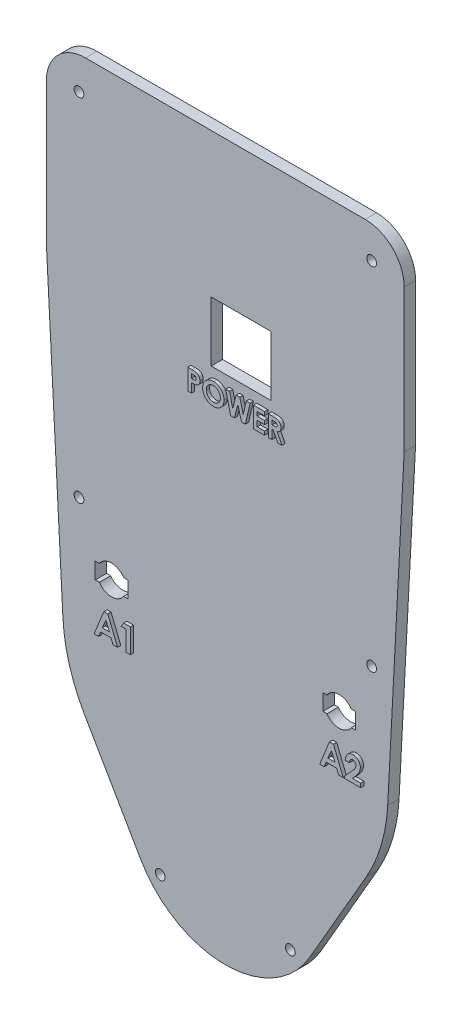
from build123d import *

# Parameters (mm, degrees)
SKETCH5_R           = 1.5
SKETCH5_W           = 18.4
SKETCH5_H           = 18.4
BOSS_EXTRUDE2_DEPTH = 3.5
BOSS_EXTRUDE3_DEPTH = 1


with BuildPart() as part:
    # Sketch5 → Boss-Extrude2 (new body)
    with BuildSketch(Plane.XY):
        with BuildLine():
            Line((54.996270394, 98.017748309), (54.996270394, 54.11413567))
            Line((54.996270394, 54.11413567), (49.927747132, -42.599049503))
            ThreePointArc((49.927747132, -42.599049503), (47.937257137, -54.183018926), (43.297540583, -64.982251691))
            Line((43.297540583, -64.982251691), (25.977032507, -94.982251691))
            ThreePointArc((25.977032507, -94.982251691), (-0.003729606, -109.982251691), (-25.98449172, -94.982251691))
            Line((-25.98449172, -94.982251691), (-43.304999795, -64.982251691))
            ThreePointArc((-43.304999795, -64.982251691), (-47.944716349, -54.183018926), (-49.935206344, -42.599049503))
            Line((-49.935206344, -42.599049503), (-55.003729606, 54.11413567))
            Line((-55.003729606, 54.11413567), (-55.003729606, 98.017748309))
            ThreePointArc((-55.003729606, 98.017748309), (-51.48901098, 106.503029684), (-43.003729606, 110.017748309))
            Line((-43.003729606, 110.017748309), (42.996270394, 110.017748309))
            ThreePointArc((42.996270394, 110.017748309), (51.481551768, 106.503029684), (54.996270394, 98.017748309))
        make_face()
        with Locations((20, -96)):
            Circle(SKETCH5_R, mode=Mode.SUBTRACT)
        with Locations((-20, -96)):
            Circle(SKETCH5_R, mode=Mode.SUBTRACT)
        with Locations((45, -7.999756325)):
            Circle(SKETCH5_R, mode=Mode.SUBTRACT)
        with Locations((-45, -7.999756325)):
            Circle(SKETCH5_R, mode=Mode.SUBTRACT)
        with Locations((45, 100)):
            Circle(SKETCH5_R, mode=Mode.SUBTRACT)
        with Locations((-45, 100)):
            Circle(SKETCH5_R, mode=Mode.SUBTRACT)
        with BuildLine():
            ThreePointArc((31.258343135, -27.5), (35.000000522, -29.5), (38.741657908, -27.5))
            Line((38.741657908, -27.5), (40.000000522, -27.5))
            Line((40.000000522, -27.5), (40.000000522, -22.5))
            Line((40.000000522, -22.5), (38.741657908, -22.5))
            ThreePointArc((38.741657908, -22.5), (35.000000522, -20.5), (31.258343135, -22.5))
            Line((31.258343135, -22.5), (30.000000522, -22.5))
            Line((30.000000522, -22.5), (30.000000522, -27.5))
            Line((30.000000522, -27.5), (31.258343135, -27.5))
        make_face(mode=Mode.SUBTRACT)
        with BuildLine():
            ThreePointArc((-31.258343135, -22.5), (-35.000000522, -20.5), (-38.741657908, -22.5))
            Line((-38.741657908, -22.5), (-40.000000522, -22.5))
            Line((-40.000000522, -22.5), (-40.000000522, -27.5))
            Line((-40.000000522, -27.5), (-38.741657908, -27.5))
            ThreePointArc((-38.741657908, -27.5), (-35.000000522, -29.5), (-31.258343135, -27.5))
            Line((-31.258343135, -27.5), (-30.000000522, -27.5))
            Line((-30.000000522, -27.5), (-30.000000522, -22.5))
            Line((-30.000000522, -22.5), (-31.258343135, -22.5))
        make_face(mode=Mode.SUBTRACT)
        with Locations((4.859065871, 56.4953)):
            Rectangle(SKETCH5_W, SKETCH5_H, mode=Mode.SUBTRACT)
    extrude(amount=BOSS_EXTRUDE2_DEPTH)

    # Sketch6 → Boss-Extrude3 (add)
    # profile 1 of 9: a face of its own
    with BuildSketch(Plane.XY.offset(3.5)):
        with BuildLine():
            Line((-10.544251547, 44.383539956), (-9.27221629, 44.383539956))
            add(Edge.make_bspline(
                [(-9.27221629, 44.383539956), (-9.189103157, 44.383167924), (-9.028760501, 44.382450196), (-8.797533199, 44.373746791), (-8.584214691, 44.35814976), (-8.388853988, 44.338874295), (-8.211531416, 44.311850843), (-8.052024914, 44.280870572), (-7.910301381, 44.243127584), (-7.784762674, 44.198327182), (-7.672095739, 44.145509257), (-7.56547648, 44.089254397), (-7.467314505, 44.022116206), (-7.372655281, 43.951330553), (-7.286910639, 43.870135311), (-7.204731317, 43.783934142), (-7.129597831, 43.689308378), (-7.061162042, 43.587403439), (-6.999080236, 43.480102092), (-6.944841417, 43.367212514), (-6.900845925, 43.248556069), (-6.863939177, 43.12490033), (-6.834295318, 42.996250686), (-6.814563422, 42.86181593), (-6.801160525, 42.722534736), (-6.799977905, 42.627739867), (-6.799379752, 42.579793963)],
                knots=[0, 0, 0, 0, 1.698747864, 3.27724071, 4.728299578, 6.070144658, 7.288476769, 8.393259625, 9.389771311, 10.283485332, 11.113357557, 11.931608583, 12.74405601, 13.541433047, 14.344816069, 15.154114104, 15.974336324, 16.810834471, 17.661136416, 18.50621059, 19.367396281, 20.244825668, 21.142564693, 22.063065223, 23.020325768, 24, 24, 24, 24], degree=3))
            add(Edge.make_bspline(
                [(-6.799379752, 42.579793963), (-6.800245204, 42.52675255), (-6.801945924, 42.422519656), (-6.818618459, 42.269727022), (-6.847100417, 42.124053079), (-6.884324846, 41.984269332), (-6.936231665, 41.852675535), (-6.995532768, 41.726131818), (-7.068491934, 41.60818608), (-7.151859446, 41.49736296), (-7.242906279, 41.392761416), (-7.343793882, 41.297401618), (-7.452599295, 41.210633502), (-7.56869268, 41.131547731), (-7.692509888, 41.06030384), (-7.823961578, 40.996234704), (-7.963945378, 40.941389454), (-8.061425884, 40.912705832), (-8.110848101, 40.898163354)],
                knots=[0, 0, 0, 0, 1.102006807, 2.165578795, 3.188629044, 4.184801286, 5.166646146, 6.124351954, 7.085497154, 8.042432466, 9.003981491, 9.963833307, 10.922997304, 11.89326795, 12.880200226, 13.889073926, 14.929769137, 16, 16, 16, 16], degree=3))
            add(Edge.make_bspline(
                [(-8.110848101, 40.898163354), (-8.143400416, 40.890064285), (-8.213919213, 40.872519094), (-8.330608453, 40.854706322), (-8.46508055, 40.838328573), (-8.617770341, 40.82425388), (-8.788765855, 40.814686369), (-8.977901523, 40.807214568), (-9.185263059, 40.801781797), (-9.329454071, 40.801589019), (-9.404507957, 40.801488674)],
                knots=[0, 0, 0, 0, 0.618981996, 1.340914327, 2.176866532, 3.120127938, 4.170906482, 5.338178032, 6.614476169, 8, 8, 8, 8], degree=3))
            Line((-9.404507957, 40.801488674), (-9.404507957, 38.033539956))
            Line((-9.404507957, 38.033539956), (-10.544251547, 38.033539956))
            Line((-10.544251547, 38.033539956), (-10.544251547, 44.383539956))
        make_face()
        with BuildLine():
            Line((-9.404507957, 41.941232264), (-9.001272781, 41.941232264))
            add(Edge.make_bspline(
                [(-9.001272781, 41.941232264), (-8.927897774, 41.941697518), (-8.792886672, 41.942553594), (-8.608509184, 41.954932938), (-8.460339887, 41.973838698), (-8.343283392, 42.00095393), (-8.250856201, 42.042104885), (-8.171143536, 42.08970879), (-8.102771948, 42.149902622), (-8.043572216, 42.218684374), (-7.996243814, 42.297718055), (-7.963424033, 42.385716754), (-7.942104948, 42.480831525), (-7.940135933, 42.54702511), (-7.939123342, 42.581065998)],
                knots=[0, 0, 0, 0, 1.8619151, 3.425951444, 4.686033666, 5.651700536, 6.461346321, 7.243864085, 7.999046032, 8.762387399, 9.539336099, 10.322741239, 11.137448474, 12, 12, 12, 12], degree=3))
            add(Edge.make_bspline(
                [(-7.939123342, 42.581065998), (-7.940125517, 42.610807079), (-7.942069978, 42.668511926), (-7.956354517, 42.751794333), (-7.979119963, 42.829430717), (-8.01210622, 42.900610268), (-8.054749639, 42.965212042), (-8.106740597, 43.023210589), (-8.167411946, 43.075847996), (-8.214253775, 43.10370978), (-8.238051627, 43.117864876)],
                knots=[0, 0, 0, 0, 1.102301479, 2.1387299, 3.123554645, 4.094223062, 5.036071848, 5.982632524, 6.975082478, 8, 8, 8, 8], degree=3))
            add(Edge.make_bspline(
                [(-8.238051627, 43.117864876), (-8.258209781, 43.128059433), (-8.300888723, 43.149643398), (-8.373575101, 43.174736335), (-8.45745407, 43.195904992), (-8.553091909, 43.213474773), (-8.660107091, 43.227110748), (-8.778480522, 43.237538858), (-8.908386401, 43.241732407), (-8.998728167, 43.243089404), (-9.045794015, 43.243796367)],
                knots=[0, 0, 0, 0, 0.656809284, 1.390599849, 2.23162475, 3.173112763, 4.218524733, 5.370385145, 6.63003504, 8, 8, 8, 8], degree=3))
            Line((-9.045794015, 43.243796367), (-9.404507957, 43.243796367))
            Line((-9.404507957, 43.243796367), (-9.404507957, 41.941232264))
        make_face(mode=Mode.SUBTRACT)
    # profile 2 of 9: a face of its own
    with BuildSketch(Plane.XY.offset(3.5)):
        with BuildLine():
            add(Edge.make_bspline(
                [(-2.675441451, 44.546360469), (-2.565038918, 44.54350195), (-2.347079314, 44.537858585), (-2.026539389, 44.490816738), (-1.717639904, 44.414168792), (-1.420520542, 44.307622603), (-1.135925256, 44.168292358), (-0.862850182, 44.000128163), (-0.602273464, 43.799956017), (-0.356865282, 43.572445608), (-0.130063861, 43.325037972), (0.066459702, 43.058659667), (0.234047787, 42.780212821), (0.37294524, 42.488951328), (0.478741504, 42.182858064), (0.552983119, 41.863493699), (0.600679678, 41.530949091), (0.606165516, 41.304531539), (0.608953581, 41.189459427)],
                knots=[0, 0, 0, 0, 1.014329547, 2.002516266, 2.970391464, 3.935626869, 4.897733899, 5.877609409, 6.878433252, 7.912639331, 8.949961323, 9.958554974, 10.949718813, 11.932905612, 12.9188844, 13.919928257, 14.942845884, 16, 16, 16, 16], degree=3))
            add(Edge.make_bspline(
                [(0.608953581, 41.189459427), (0.605984412, 41.075683913), (0.600133569, 40.851485611), (0.554930301, 40.522005532), (0.479438449, 40.206062226), (0.375436572, 39.902940547), (0.239058194, 39.614108712), (0.074738259, 39.337722572), (-0.121859323, 39.076347055), (-0.343563867, 38.830122426), (-0.587641328, 38.60662074), (-0.846158107, 38.409660266), (-1.117920532, 38.242763393), (-1.40253083, 38.106006568), (-1.700599334, 37.999874632), (-2.011389778, 37.92499084), (-2.334882931, 37.879482447), (-2.554873963, 37.873669821), (-2.666537204, 37.870719443)],
                knots=[0, 0, 0, 0, 1.051557043, 2.072126891, 3.067553643, 4.050577992, 5.02905126, 6.015227836, 7.017913613, 8.04756643, 9.074058332, 10.072836633, 11.047628519, 12.017157415, 12.98668631, 13.966869689, 14.968021931, 16, 16, 16, 16], degree=3))
            add(Edge.make_bspline(
                [(-2.666537204, 37.870719443), (-2.783323565, 37.873366078), (-3.012792801, 37.878566353), (-3.348622056, 37.928018591), (-3.6703755, 38.002510937), (-3.975350219, 38.113686767), (-4.266652121, 38.252665904), (-4.542140923, 38.423827043), (-4.801724045, 38.626887327), (-5.043912475, 38.856646307), (-5.263335778, 39.108053025), (-5.457019884, 39.373641929), (-5.620396724, 39.651384152), (-5.753472275, 39.941409683), (-5.858383694, 40.241916085), (-5.93238678, 40.554733528), (-5.976102168, 40.879111763), (-5.982191468, 41.099435944), (-5.985277188, 41.211084027)],
                knots=[0, 0, 0, 0, 1.067978421, 2.098431617, 3.099715153, 4.085208694, 5.062210972, 6.048429807, 7.046490867, 8.072918869, 9.098532598, 10.095778865, 11.076610158, 12.041847152, 13.011192615, 13.984257998, 14.978533688, 16, 16, 16, 16], degree=3))
            add(Edge.make_bspline(
                [(-5.985277188, 41.211084027), (-5.984308711, 41.286195012), (-5.982384021, 41.435465904), (-5.959199102, 41.656677748), (-5.925819485, 41.873571833), (-5.876452615, 42.0852834), (-5.816484486, 42.293305976), (-5.738787304, 42.495703234), (-5.650346883, 42.694637335), (-5.547012579, 42.887758618), (-5.432114824, 43.073290204), (-5.306751144, 43.25035691), (-5.170606313, 43.41681774), (-5.024118899, 43.573766607), (-4.866784086, 43.720171873), (-4.700671452, 43.858106109), (-4.522559379, 43.983905291), (-4.336346181, 44.100641687), (-4.143081685, 44.206204385), (-3.943552652, 44.296056197), (-3.741869777, 44.374522254), (-3.535338846, 44.436451135), (-3.326173206, 44.486891561), (-3.112138347, 44.520248681), (-2.895167951, 44.543432957), (-2.748857436, 44.545382316), (-2.675441451, 44.546360469)],
                knots=[0, 0, 0, 0, 1.034744296, 2.056386356, 3.06226378, 4.057406941, 5.050368692, 6.043467995, 7.042652155, 8.049140477, 9.059438543, 10.048523776, 11.036952808, 12.020949711, 13.004946614, 13.997082645, 14.994316842, 16.007702937, 17.024872941, 18.026463647, 19.021641123, 20.005082605, 20.995858141, 21.984425357, 22.988620895, 24, 24, 24, 24], degree=3))
        make_face()
        with BuildLine():
            add(Edge.make_bspline(
                [(-2.693249944, 43.406616879), (-2.767550834, 43.40462322), (-2.914191058, 43.400688533), (-3.12928556, 43.370711544), (-3.335783879, 43.322834886), (-3.532541311, 43.253486131), (-3.720410622, 43.165222766), (-3.899724845, 43.058353195), (-4.068000848, 42.929203896), (-4.22748243, 42.784708319), (-4.371547797, 42.623707038), (-4.498834093, 42.451166785), (-4.605352221, 42.267375698), (-4.69456182, 42.074041154), (-4.761716877, 41.868989156), (-4.80954941, 41.6538259), (-4.839777786, 41.428180647), (-4.84358811, 41.274358573), (-4.845533598, 41.195819604)],
                knots=[0, 0, 0, 0, 1.033739768, 2.040188636, 3.016340934, 3.979330865, 4.937572243, 5.900995986, 6.878200029, 7.884839167, 8.891893314, 9.879764717, 10.863503415, 11.843163062, 12.837761627, 13.859916423, 14.907309254, 16, 16, 16, 16], degree=3))
            add(Edge.make_bspline(
                [(-4.845533598, 41.195819604), (-4.842954179, 41.108780759), (-4.837898944, 40.938199045), (-4.802329695, 40.689359037), (-4.741474253, 40.454354346), (-4.653600177, 40.234334346), (-4.544613268, 40.026855879), (-4.409268825, 39.83446189), (-4.249758787, 39.656000411), (-4.126873546, 39.551807167), (-4.064503951, 39.498924572)],
                knots=[0, 0, 0, 0, 1.078454662, 2.113592447, 3.107694534, 4.079536787, 5.043276885, 6.005368276, 6.987637804, 8, 8, 8, 8], degree=3))
            add(Edge.make_bspline(
                [(-4.064503951, 39.498924572), (-4.013411345, 39.459856942), (-3.91237726, 39.382601882), (-3.751104862, 39.283583674), (-3.585026049, 39.198715192), (-3.412887547, 39.130142463), (-3.235052904, 39.076204307), (-3.051546506, 39.038432303), (-2.862628367, 39.014727104), (-2.734873067, 39.011893883), (-2.67035331, 39.010463033)],
                knots=[0, 0, 0, 0, 1.023928204, 2.024787132, 3.009472467, 3.9914905, 4.972207045, 5.96565515, 6.972602802, 8, 8, 8, 8], degree=3))
            add(Edge.make_bspline(
                [(-2.67035331, 39.010463033), (-2.597330026, 39.012473597), (-2.453654418, 39.016429444), (-2.242564015, 39.0460374), (-2.040332999, 39.096144751), (-1.8457059, 39.164885154), (-1.659243938, 39.254256742), (-1.481858402, 39.364441071), (-1.313238287, 39.494085222), (-1.153959882, 39.640478343), (-1.008371891, 39.802113857), (-0.881351215, 39.975574422), (-0.771446343, 40.157038183), (-0.684091858, 40.349073483), (-0.614283657, 40.5498676), (-0.567026813, 40.760309807), (-0.536543076, 40.979532582), (-0.532731678, 41.128721428), (-0.530790008, 41.204723851)],
                knots=[0, 0, 0, 0, 1.026359118, 2.019393844, 2.989460624, 3.950973911, 4.916101784, 5.890408035, 6.881132271, 7.902007068, 8.92769091, 9.933912415, 10.920395702, 11.90457117, 12.894218921, 13.903490204, 14.931958862, 16, 16, 16, 16], degree=3))
            add(Edge.make_bspline(
                [(-0.530790008, 41.204723851), (-0.53279886, 41.280289239), (-0.536752979, 41.429028181), (-0.566413046, 41.647687335), (-0.616202629, 41.857200502), (-0.685149453, 42.057909837), (-0.773190895, 42.250012112), (-0.882063071, 42.43283178), (-1.01138396, 42.606192099), (-1.15817725, 42.768911686), (-1.317952725, 42.918440563), (-1.489487661, 43.048204447), (-1.66798232, 43.160965136), (-1.857532239, 43.249297307), (-2.054259385, 43.31967136), (-2.259364198, 43.371495823), (-2.473623526, 43.400477943), (-2.619388577, 43.404552327), (-2.693249944, 43.406616879)],
                knots=[0, 0, 0, 0, 1.055025985, 2.07665775, 3.074803781, 4.057872707, 5.035505728, 6.020516407, 7.023567878, 8.050795229, 9.077271434, 10.074415901, 11.050397877, 12.019801805, 12.988065821, 13.964604439, 14.968634123, 16, 16, 16, 16], degree=3))
        make_face(mode=Mode.SUBTRACT)
    # profile 3 of 9: a face of its own
    with BuildSketch(Plane.XY.offset(3.5)):
        Polygon((1.138120248, 44.383539956), (2.31475286, 44.383539956), (3.254786915, 40.329563594), (4.332200777, 44.383539956), (5.440143485, 44.383539956), (6.511197171, 40.329563594), (7.448687155, 44.383539956), (8.627863838, 44.383539956), (7.158663117, 38.033539956), (5.968038117, 38.033539956), (4.882992043, 42.138397729), (3.791585793, 38.033539956), (2.60986504, 38.033539956), align=None)
    # profile 4 of 9: a face of its own
    with BuildSketch(Plane.XY.offset(3.5)):
        Polygon((9.645492043, 44.383539956), (13.064722812, 44.383539956), (13.064722812, 43.243796367), (10.785235633, 43.243796367), (10.785235633, 42.02264252), (13.064722812, 42.02264252), (13.064722812, 40.882898931), (10.785235633, 40.882898931), (10.785235633, 39.173283546), (13.064722812, 39.173283546), (13.064722812, 38.033539956), (9.645492043, 38.033539956), align=None)
    # profile 5 of 9: a face of its own
    with BuildSketch(Plane.XY.offset(3.5)):
        with BuildLine():
            Line((14.204466402, 44.383539956), (15.53247121, 44.383539956))
            add(Edge.make_bspline(
                [(15.53247121, 44.383539956), (15.620251923, 44.383228385), (15.789078962, 44.382629146), (16.03251833, 44.37317474), (16.256150869, 44.360018159), (16.460307685, 44.339940867), (16.644901438, 44.313320804), (16.810117133, 44.281940155), (16.955949942, 44.246175177), (17.083629763, 44.201609194), (17.198854487, 44.15133944), (17.306259949, 44.093578571), (17.408215674, 44.028969772), (17.504040197, 43.955813011), (17.594566256, 43.875424361), (17.679964634, 43.787722902), (17.759028572, 43.691964961), (17.831268504, 43.588755608), (17.897109387, 43.480181736), (17.955298918, 43.366094271), (18.002618742, 43.246413874), (18.044430879, 43.122870184), (18.074546806, 42.993697122), (18.095491993, 42.860152207), (18.11082724, 42.721765349), (18.111708943, 42.627751462), (18.11215871, 42.579793963)],
                knots=[0, 0, 0, 0, 1.749336639, 3.364467119, 4.854658419, 6.213483162, 7.451590619, 8.570285859, 9.5643256, 10.440900261, 11.26203566, 12.067320669, 12.869050712, 13.665104639, 14.467235401, 15.27997916, 16.102287765, 16.939272006, 17.78853747, 18.631303466, 19.488103222, 20.351255419, 21.228522269, 22.127379805, 23.044756219, 24, 24, 24, 24], degree=3))
            add(Edge.make_bspline(
                [(18.11215871, 42.579793963), (18.110990378, 42.529737351), (18.108699493, 42.431585458), (18.096359541, 42.287408332), (18.073805984, 42.149469743), (18.039645342, 42.018173558), (18.000382121, 41.891885643), (17.948172108, 41.772936088), (17.889247948, 41.659594945), (17.819265445, 41.553465468), (17.742463066, 41.452190308), (17.653143516, 41.359649692), (17.557093329, 41.270869913), (17.448913173, 41.191411835), (17.333371731, 41.11590279), (17.208173316, 41.047471487), (17.074135016, 40.984397719), (16.979899453, 40.949223429), (16.931709992, 40.93123627)],
                knots=[0, 0, 0, 0, 1.099860209, 2.156625411, 3.176576793, 4.16617041, 5.135385252, 6.078461593, 7.016046972, 7.938469504, 8.868247731, 9.803980173, 10.76021508, 11.73834243, 12.748633912, 13.790971185, 14.870363756, 16, 16, 16, 16], degree=3))
            Line((16.931709992, 40.93123627), (18.397094607, 38.033539956))
            Line((18.397094607, 38.033539956), (17.130147492, 38.033539956))
            Line((17.130147492, 38.033539956), (15.73090871, 40.801488674))
            Line((15.73090871, 40.801488674), (15.344209992, 40.801488674))
            Line((15.344209992, 40.801488674), (15.344209992, 38.033539956))
            Line((15.344209992, 38.033539956), (14.204466402, 38.033539956))
            Line((14.204466402, 38.033539956), (14.204466402, 44.383539956))
        make_face()
        with BuildLine():
            Line((15.344209992, 41.941232264), (15.788150296, 41.941232264))
            add(Edge.make_bspline(
                [(15.788150296, 41.941232264), (15.842425689, 41.94184355), (15.946351403, 41.943014031), (16.09581023, 41.948443208), (16.231554489, 41.961524843), (16.354167111, 41.978052999), (16.464265073, 41.997137142), (16.560866338, 42.024485877), (16.645459387, 42.053790739), (16.717041786, 42.090209082), (16.778200144, 42.131624636), (16.831006471, 42.178673735), (16.874684875, 42.233127076), (16.91063443, 42.293504852), (16.938599275, 42.36034109), (16.959011469, 42.43290208), (16.970418867, 42.512014384), (16.971731327, 42.566612646), (16.97241512, 42.595058386)],
                knots=[0, 0, 0, 0, 1.688639943, 3.233382647, 4.650958383, 5.928841754, 7.082724185, 8.122798841, 9.049171256, 9.863274652, 10.613301712, 11.341792392, 12.054588806, 12.776240173, 13.521029143, 14.301969904, 15.115324896, 16, 16, 16, 16], degree=3))
            add(Edge.make_bspline(
                [(16.97241512, 42.595058386), (16.971122347, 42.628711773), (16.968582934, 42.694817616), (16.943384071, 42.789986851), (16.903272923, 42.878072489), (16.848291525, 42.958676537), (16.779049603, 43.02933961), (16.699589035, 43.091629672), (16.608194869, 43.140883992), (16.523570748, 43.173371617), (16.446582579, 43.192809298), (16.377103185, 43.207294087), (16.296645629, 43.217559872), (16.205149169, 43.228448564), (16.102847033, 43.23550933), (15.989181614, 43.240662282), (15.864479356, 43.242770607), (15.777550039, 43.243444602), (15.732180745, 43.243796367)],
                knots=[0, 0, 0, 0, 1.020303359, 2.004196876, 2.966617323, 3.9489082, 4.950758222, 5.960522915, 7.003732012, 8.091992268, 8.70421221, 9.413913587, 10.24622431, 11.166358409, 12.212345909, 13.359657661, 14.621978493, 16, 16, 16, 16], degree=3))
            Line((15.732180745, 43.243796367), (15.344209992, 43.243796367))
            Line((15.344209992, 43.243796367), (15.344209992, 41.941232264))
        make_face(mode=Mode.SUBTRACT)
    # profile 6 of 9: a face of its own
    with BuildSketch(Plane.XY.offset(3.5)):
        Polygon((-36.357786427, -33.618197033), (-35.124548246, -33.618197033), (-32.132721323, -41.026530366), (-33.552948687, -41.026530366), (-34.128756646, -39.506872246), (-37.356546109, -39.506872246), (-37.932354069, -41.026530366), (-39.351097391, -41.026530366), align=None)
        Polygon((-35.741909357, -35.605328109), (-36.851972124, -38.177171392), (-34.63184659, -38.177171392), align=None, mode=Mode.SUBTRACT)
    # profile 7 of 9: a face of its own
    with BuildSketch(Plane.XY.offset(3.5)):
        Polygon((-30.246505044, -33.618197033), (-28.191108075, -33.618197033), (-28.191108075, -41.026530366), (-29.52080893, -41.026530366), (-29.52080893, -34.852919255), (-31.04046705, -34.852919255), align=None)
    # profile 8 of 9: a face of its own
    with BuildSketch(Plane.XY.offset(3.5)):
        Polygon((33.0173359, -33.618197033), (34.250574081, -33.618197033), (37.242401004, -41.026530366), (35.822173641, -41.026530366), (35.246365681, -39.506872246), (32.018576218, -39.506872246), (31.442768259, -41.026530366), (30.024024936, -41.026530366), align=None)
        Polygon((33.63321297, -35.605328109), (32.523150203, -38.177171392), (34.743275737, -38.177171392), align=None, mode=Mode.SUBTRACT)
    # profile 9 of 9: a face of its own
    with BuildSketch(Plane.XY.offset(3.5)):
        with BuildLine():
            Line((39.18946297, -36.087641477), (37.859762115, -36.087641477))
            add(Edge.make_bspline(
                [(37.859762115, -36.087641477), (37.865504889, -35.987056642), (37.876725925, -35.790519914), (37.921360369, -35.505044023), (37.981168992, -35.235300698), (38.06099154, -34.98223353), (38.161293793, -34.745934477), (38.279494718, -34.525597982), (38.418614078, -34.322384121), (38.575690957, -34.137272907), (38.748058621, -33.971207928), (38.932138548, -33.823964286), (39.130746489, -33.702462537), (39.340253714, -33.602477847), (39.560624548, -33.522594726), (39.793944047, -33.469186395), (40.038192002, -33.43301775), (40.205399506, -33.429852848), (40.29062149, -33.428239768)],
                knots=[0, 0, 0, 0, 1.199038563, 2.342849363, 3.436047546, 4.486744587, 5.497670872, 6.488682221, 7.459191391, 8.424610317, 9.374430501, 10.305433194, 11.225809216, 12.140057399, 13.06607119, 14.010487599, 14.985989317, 16, 16, 16, 16], degree=3))
            add(Edge.make_bspline(
                [(40.29062149, -33.428239768), (40.395230268, -33.431503837), (40.599451115, -33.437876066), (40.896200206, -33.492233293), (41.173331411, -33.583154154), (41.430643282, -33.710194576), (41.665945278, -33.871586114), (41.87919838, -34.064019111), (42.063953473, -34.29153091), (42.221381959, -34.544655117), (42.352186216, -34.812678028), (42.443848391, -35.089824832), (42.504096952, -35.368741178), (42.510522834, -35.556549327), (42.513715107, -35.649849343)],
                knots=[0, 0, 0, 0, 1.075374347, 2.099382735, 3.09057751, 4.06680945, 5.040638231, 6.016817125, 7.011024321, 8.044445721, 9.0776792, 10.070479129, 11.0414456, 12, 12, 12, 12], degree=3))
            add(Edge.make_bspline(
                [(42.513715107, -35.649849343), (42.512472204, -35.706283787), (42.509970549, -35.819872382), (42.492576204, -35.991759806), (42.466481249, -36.166847243), (42.427136417, -36.344984572), (42.378070186, -36.526221728), (42.318545755, -36.711101092), (42.247182398, -36.898574465), (42.165171023, -37.090751828), (42.067331245, -37.288257106), (41.953410424, -37.49405098), (41.820384842, -37.707950894), (41.66986128, -37.931164597), (41.501108683, -38.163340047), (41.313303255, -38.403777857), (41.108608074, -38.653325256), (40.963330146, -38.820133688), (40.888690067, -38.905835588)],
                knots=[0, 0, 0, 0, 0.728284026, 1.46585585, 2.227944881, 3.01186502, 3.81876927, 4.650621989, 5.517437689, 6.406905708, 7.346299482, 8.360816762, 9.441613733, 10.596154504, 11.834900912, 13.145207542, 14.533280747, 16, 16, 16, 16], degree=3))
            Line((40.888690067, -38.905835588), (40.115504637, -39.791808144))
            Line((40.115504637, -39.791808144), (42.608693739, -39.791808144))
            Line((42.608693739, -39.791808144), (42.608693739, -41.026530366))
            Line((42.608693739, -41.026530366), (37.66980485, -41.026530366))
            Line((37.66980485, -41.026530366), (37.66980485, -40.352775692))
            Line((37.66980485, -40.352775692), (39.863217644, -38.018378991))
            add(Edge.make_bspline(
                [(39.863217644, -38.018378991), (39.926722581, -37.950283914), (40.049712811, -37.818403944), (40.224715234, -37.624724179), (40.383076968, -37.440926704), (40.521514253, -37.265054448), (40.647292101, -37.102811992), (40.754802086, -36.949309144), (40.845027842, -36.805933626), (40.942980696, -36.633047792), (41.036003709, -36.42685067), (41.121357952, -36.189303131), (41.173387271, -35.962262392), (41.180568962, -35.814317766), (41.184014252, -35.743343934)],
                knots=[0, 0, 0, 0, 1.246127091, 2.413378631, 3.493388633, 4.492180848, 5.408488754, 6.240484944, 6.999099869, 7.674939598, 8.898438119, 10.020720584, 11.050475521, 12, 12, 12, 12], degree=3))
            add(Edge.make_bspline(
                [(41.184014252, -35.743343934), (41.181438292, -35.674682228), (41.176446956, -35.541639163), (41.121596221, -35.352386112), (41.036619559, -35.181036794), (40.916875441, -35.032711319), (40.771827811, -34.910822441), (40.60421165, -34.820164918), (40.415393522, -34.767855943), (40.283028417, -34.761308728), (40.214935393, -34.757940622)],
                knots=[0, 0, 0, 0, 1.062038974, 2.057870785, 3.028805853, 4.01125022, 4.991535629, 5.949134679, 6.94496649, 8, 8, 8, 8], degree=3))
            add(Edge.make_bspline(
                [(40.214935393, -34.757940622), (40.179757669, -34.759184841), (40.110504671, -34.761634285), (40.008708177, -34.777939572), (39.911841499, -34.806675938), (39.818826457, -34.845178623), (39.730655733, -34.896214209), (39.647551721, -34.9591237), (39.568638815, -35.032308422), (39.494278942, -35.115539537), (39.42660175, -35.208425486), (39.366491115, -35.310117945), (39.316789627, -35.420553792), (39.27303063, -35.538275103), (39.239281599, -35.664546303), (39.214708117, -35.798611672), (39.196026539, -35.940253103), (39.191690627, -36.037618267), (39.18946297, -36.087641477)],
                knots=[0, 0, 0, 0, 0.903469896, 1.778625579, 2.63899355, 3.493148037, 4.358286772, 5.247621495, 6.164656832, 7.118446693, 8.109501108, 9.111810964, 10.146451449, 11.215617525, 12.33435995, 13.498009769, 14.714554818, 16, 16, 16, 16], degree=3))
        make_face()
    extrude(amount=BOSS_EXTRUDE3_DEPTH)


solid = part.part
